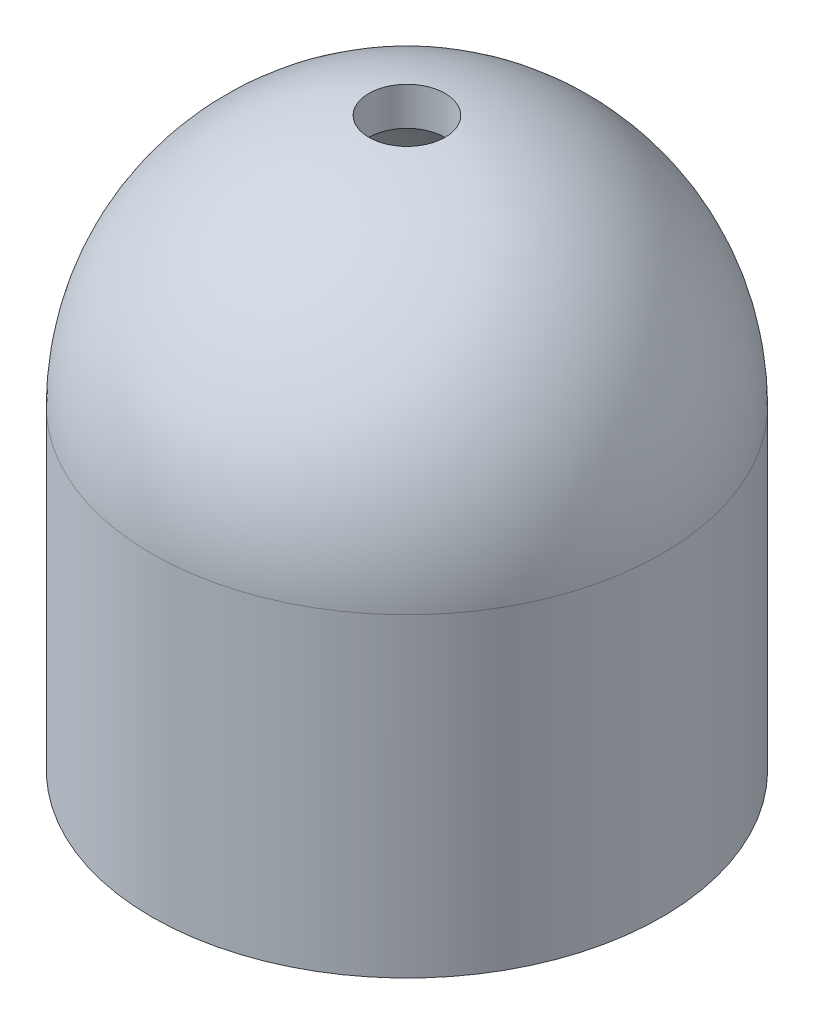
from build123d import *

# Parameters (mm, degrees)
SKETCH1_R           = 28.2321
SKETCH1_R_2         = 24.1046
BOSS_EXTRUDE1_DEPTH = 34.8234
SKETCH3_R           = 4.2164
CUT_EXTRUDE1_DEPTH  = 34.8234


with BuildPart() as part:
    # Sketch1 → Boss-Extrude1 (new body)
    with BuildSketch(Plane(origin=(0, 0, 0), x_dir=(1, 0, 0), z_dir=(0, 1, 0))):
        with Locations(Location((0, 0, 0), (0, 0, 270))):
            Circle(SKETCH1_R)
        with Locations(Location((0, 0, 0), (0, 0, 270))):
            Circle(SKETCH1_R_2, mode=Mode.SUBTRACT)
    extrude(amount=-BOSS_EXTRUDE1_DEPTH)

    # Sketch2 → Revolve1 (revolve)
    with BuildSketch(Plane.XY):
        with BuildLine():
            Line((0, 24.0665), (0, 28.2321))
            ThreePointArc((0, 28.2321), (-19.963109357, 19.963109357), (-28.2321, 0))
            Line((-28.2321, 0), (-24.0665, 0))
            ThreePointArc((-24.0665, 0), (-17.017585349, 17.017585349), (0, 24.0665))
        make_face()
    revolve(axis=Axis((0, 24.0665, 0), (0, 1, 0)))

    # Sketch3 → Cut-Extrude1 (cut)
    with BuildSketch(Plane(origin=(0, 0, 0), x_dir=(1, 0, 0), z_dir=(0, 1, 0))):
        with Locations(Location((0, 0, 0), (0, 0, 90))):
            Circle(SKETCH3_R)
    extrude(amount=CUT_EXTRUDE1_DEPTH, mode=Mode.SUBTRACT)


solid = part.part
